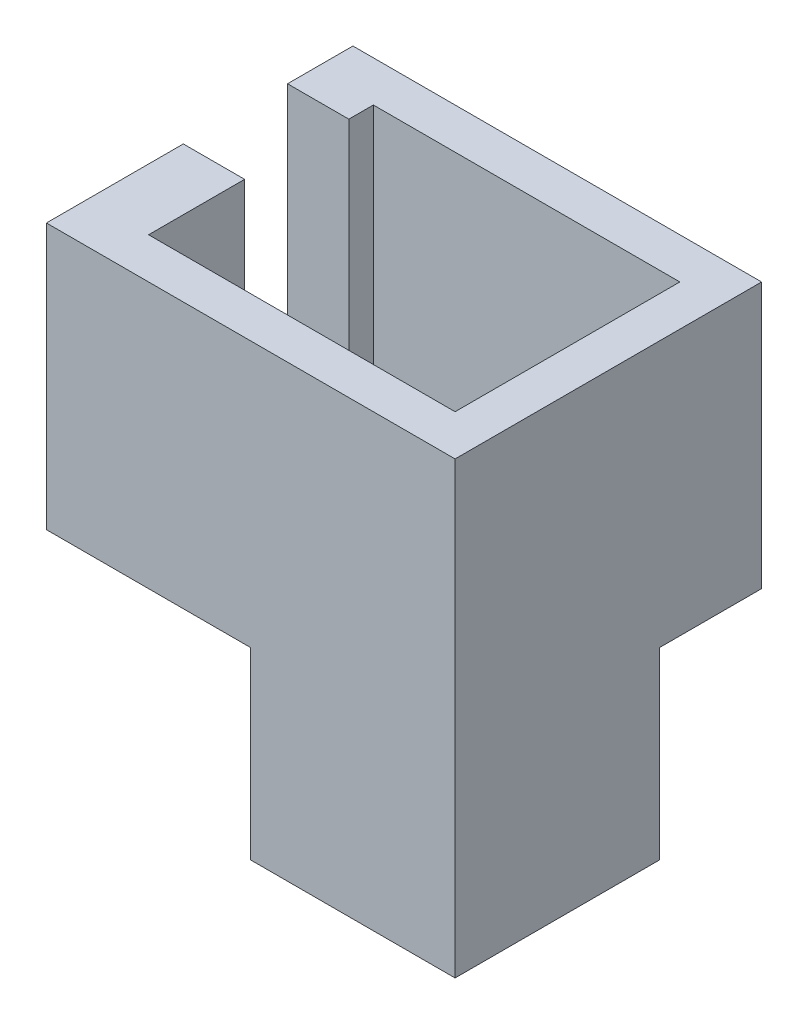
from build123d import *

# Parameters (mm, degrees)
BOSS_EXTRUDE1_DEPTH = 12
SKETCH3_W           = 20
SKETCH3_H           = 15
BOSS_EXTRUDE2_DEPTH = 1
SKETCH4_W           = 10
SKETCH4_H           = 10
BOSS_EXTRUDE3_DEPTH = 9


with BuildPart() as part:
    # Sketch1 → Boss-Extrude1 (new body)
    with BuildSketch(Plane(origin=(0, 0, 0), x_dir=(1, 0, 0), z_dir=(0, 1, 0))):
        Polygon((3, 2), (18, 2), (18, 13), (3, 13), (3, 11.8), (0, 11.8), (0, 15), (20, 15), (20, 0), (0, 0), (0, 6.7), (3, 6.7), align=None)
    extrude(amount=BOSS_EXTRUDE1_DEPTH)

    # Sketch3 → Boss-Extrude2 (add)
    with BuildSketch(Plane.XZ):
        with Locations((10, -7.5)):
            Rectangle(SKETCH3_W, SKETCH3_H)
    extrude(amount=BOSS_EXTRUDE2_DEPTH)

    # Sketch4 → Boss-Extrude3 (add)
    with BuildSketch(Plane.XZ.offset(1)):
        with Locations((15, -5)):
            Rectangle(SKETCH4_W, SKETCH4_H)
    extrude(amount=BOSS_EXTRUDE3_DEPTH)


solid = part.part
